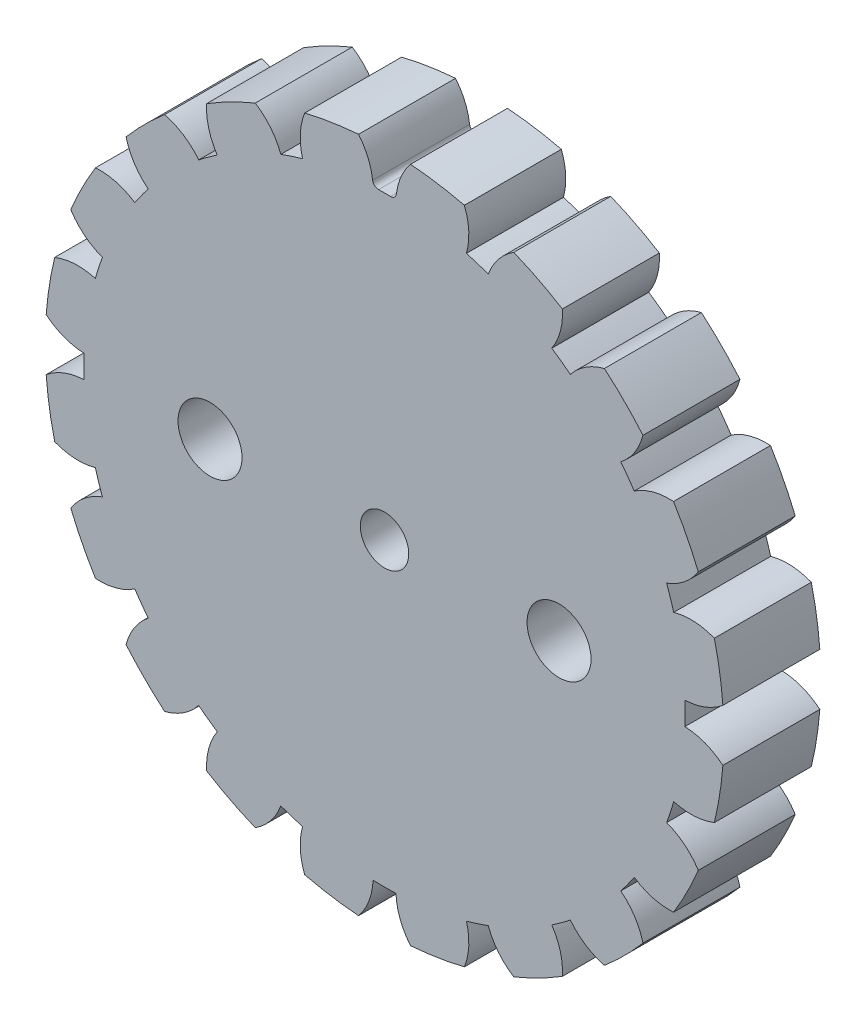
from build123d import *

# Parameters (mm, degrees)
SKETCH1_R                      = 17.5
BOSS_EXTRUDE1_DEPTH            = 2.5
CUT_EXTRUDE1_DEPTH             = 25.874685928
FILLET2_R                      = 0.3
CIRPATTERN1_COUNT              = 20
THROUGH_CENTER_HOLE_DEPTH      = 25.802421489
THROUGH_CENTER_HOLE_DEPTH_BACK = 25.802421489
SKETCH4_R                      = 1.25
TO_KNUCKLE_MOUNT_DEPTH         = 25.802421489
TO_KNUCKLE_MOUNT_DEPTH_BACK    = 25.802421489
SKETCH5_R                      = 1.65


with BuildPart() as part:
    # Sketch1 → Boss-Extrude1 (new, symmetric)
    with BuildSketch(Plane.XY):
        Circle(SKETCH1_R)
    extrude(amount=BOSS_EXTRUDE1_DEPTH, both=True)

    # Sketch3 → Cut-Extrude1 (cut, symmetric)
    with BuildSketch(Plane.XY):
        with BuildLine():
            ThreePointArc((-2.489947944, 18.331670934), (-1.138475024, 17.178633755), (-0.590517817, 15.488747164))
            ThreePointArc((-0.590517817, 15.488747164), (0, 15.5), (0.590517817, 15.488747164))
            ThreePointArc((0.590517817, 15.488747164), (1.138475024, 17.178633755), (2.489947944, 18.331670934))
            ThreePointArc((2.489947944, 18.331670934), (0, 18.5), (-2.489947944, 18.331670934))
        make_face()
    cut_extrude1 = extrude(amount=CUT_EXTRUDE1_DEPTH, both=True, mode=Mode.SUBTRACT)

    # Fillet2
    fillet2_edges = [part.edges().sort_by_distance(p)[0] for p in [
        (-0.590517817, 15.488747164, 0),
        (0.590517817, 15.488747164, 0),
    ]]
    fillet(fillet2_edges, radius=FILLET2_R)

    # CirPattern1: Cut-Extrude1 ×20 about axis
    cirpattern1_axis = Axis((0, 0, 0), (0, 0, 1))
    for i in range(1, CIRPATTERN1_COUNT):
        add(cut_extrude1.rotate(cirpattern1_axis, i * 360 / CIRPATTERN1_COUNT), mode=Mode.SUBTRACT)

    # Sketch4 → Through_Center_Hole (cut, two sides: drawn at the far end of the back side and taken through both)
    with BuildSketch(Plane.XY.offset(-THROUGH_CENTER_HOLE_DEPTH_BACK)):
        Circle(SKETCH4_R)
    extrude(amount=THROUGH_CENTER_HOLE_DEPTH + THROUGH_CENTER_HOLE_DEPTH_BACK, mode=Mode.SUBTRACT)

    # Sketch5 → To_Knuckle_Mount (cut, two sides: drawn at the far end of the back side and taken through both)
    with BuildSketch(Plane.XY.offset(-TO_KNUCKLE_MOUNT_DEPTH_BACK)):
        with Locations((9, 0)):
            Circle(SKETCH5_R)
        with Locations((-9, 0)):
            Circle(SKETCH5_R)
    extrude(amount=TO_KNUCKLE_MOUNT_DEPTH + TO_KNUCKLE_MOUNT_DEPTH_BACK, mode=Mode.SUBTRACT)


solid = part.part
